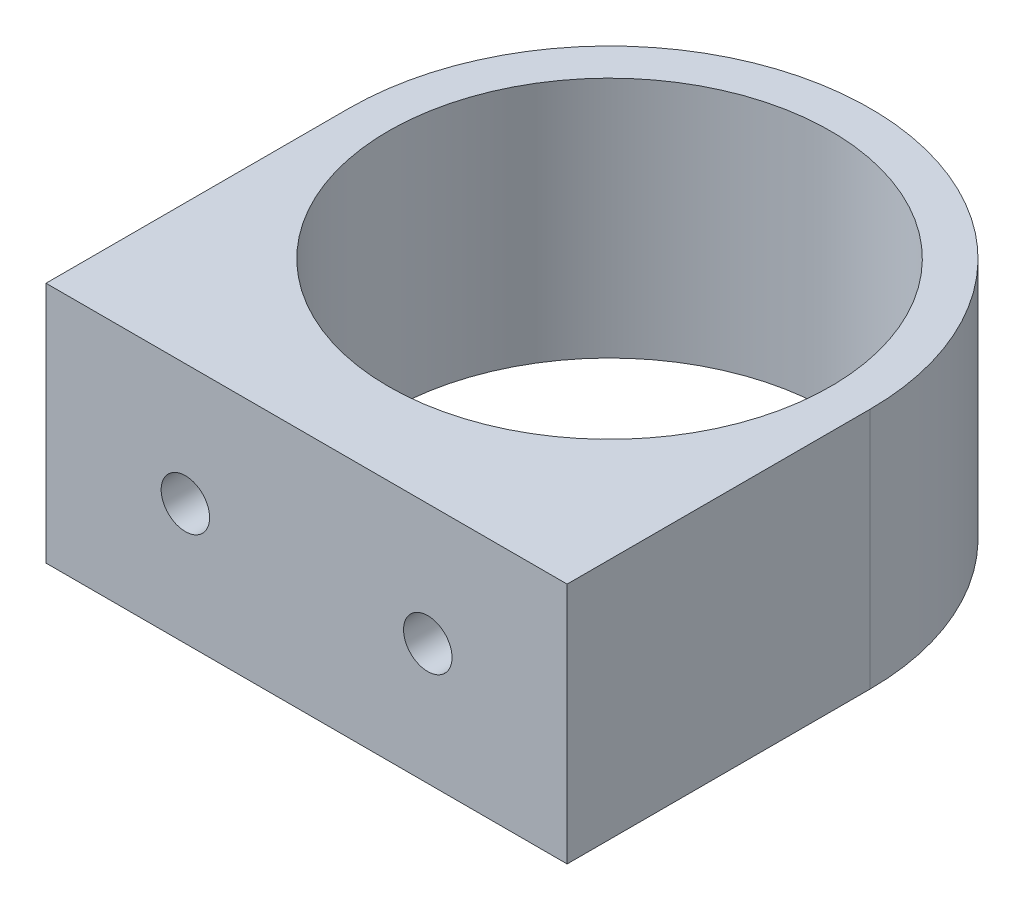
from build123d import *

# Parameters (mm, degrees)
SKETCH1_R           = 21.5
SKETCH1_R_2         = 18.25
BOSS_EXTRUDE1_DEPTH = 20
SKETCH2_R           = 2
CUT_EXTRUDE1_DEPTH  = 10


with BuildPart() as part:
    # Sketch1 → Boss-Extrude1 (new body)
    # profile 1 of 2: a face of its own
    with BuildSketch(Plane(origin=(0, 0, 0), x_dir=(1, 0, 0), z_dir=(0, 1, 0))):
        with BuildLine():
            ThreePointArc((21.5, 0), (0, -21.5), (-21.5, 0))
            Line((-21.5, 0), (-21.5, -25))
            Line((-21.5, -25), (21.5, -25))
            Line((21.5, -25), (21.5, 0))
        make_face()
    # profile 2 of 2: a face of its own
    with BuildSketch(Plane(origin=(0, 0, 0), x_dir=(1, 0, 0), z_dir=(0, 1, 0))):
        Circle(SKETCH1_R)
        with Locations(Location((0, 0, 0), (0, 0, 270))):
            Circle(SKETCH1_R_2, mode=Mode.SUBTRACT)
    extrude(amount=BOSS_EXTRUDE1_DEPTH)

    # Sketch2 → Cut-Extrude1 (cut)
    with BuildSketch(Plane.XY.offset(25)):
        with Locations((-10, 10)):
            Circle(SKETCH2_R)
        with Locations((10, 10)):
            Circle(SKETCH2_R)
    extrude(amount=-CUT_EXTRUDE1_DEPTH, mode=Mode.SUBTRACT)


solid = part.part
